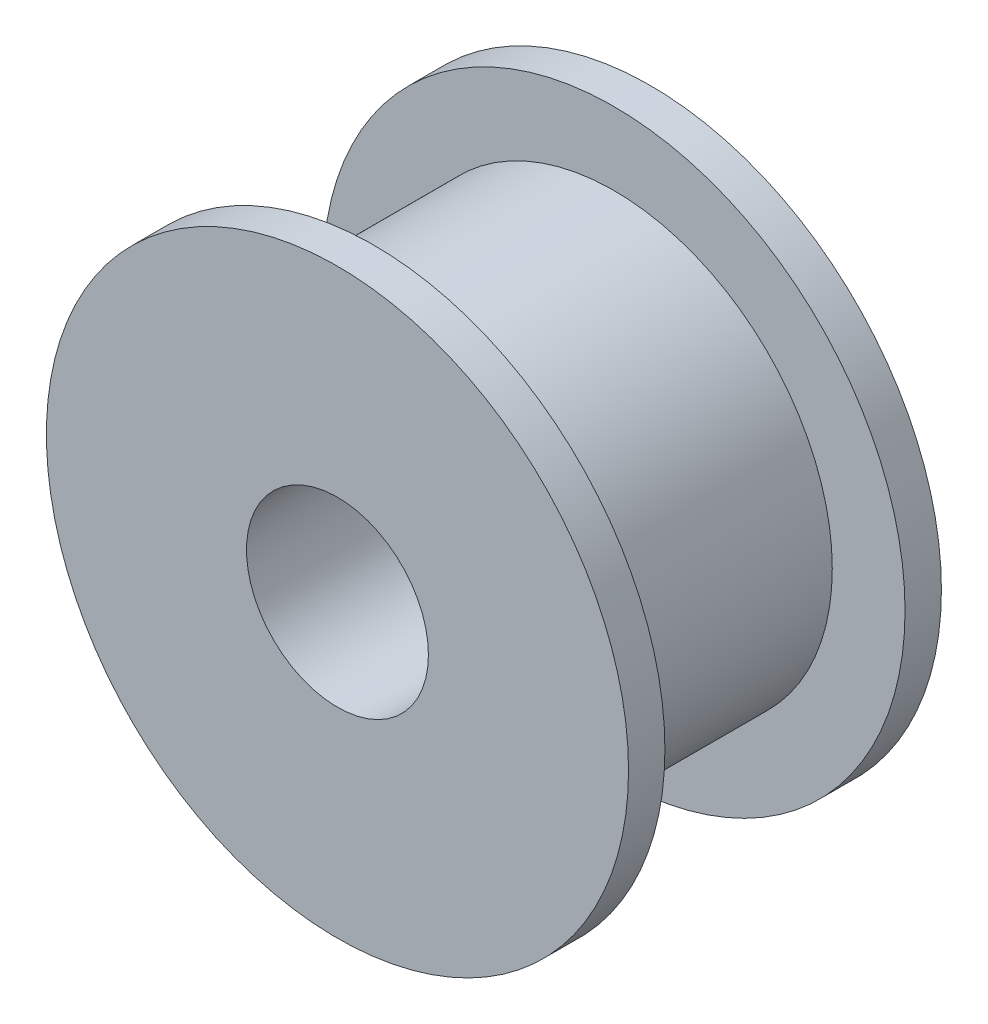
from build123d import *

# Parameters (mm, degrees)
CROQUIS1_R              = 8
CROQUIS1_R_2            = 2.5
SALIENTE_EXTRUIR1_DEPTH = 1
CROQUIS2_R              = 6
CROQUIS2_R_2            = 2.5
SALIENTE_EXTRUIR2_DEPTH = 6.6
CROQUIS3_R              = 8
CROQUIS3_R_2            = 2.5
SALIENTE_EXTRUIR3_DEPTH = 1


with BuildPart() as part:
    # Croquis1 → Saliente-Extruir1 (new body)
    with BuildSketch(Plane.XY):
        Circle(CROQUIS1_R)
        Circle(CROQUIS1_R_2, mode=Mode.SUBTRACT)
    extrude(amount=SALIENTE_EXTRUIR1_DEPTH)

    # Croquis2 → Saliente-Extruir2 (add)
    with BuildSketch(Plane.XY.offset(1)):
        Circle(CROQUIS2_R)
        Circle(CROQUIS2_R_2, mode=Mode.SUBTRACT)
    extrude(amount=SALIENTE_EXTRUIR2_DEPTH)

    # Croquis3 → Saliente-Extruir3 (add)
    with BuildSketch(Plane.XY.offset(7.6)):
        Circle(CROQUIS3_R)
        Circle(CROQUIS3_R_2, mode=Mode.SUBTRACT)
    extrude(amount=SALIENTE_EXTRUIR3_DEPTH)


solid = part.part
